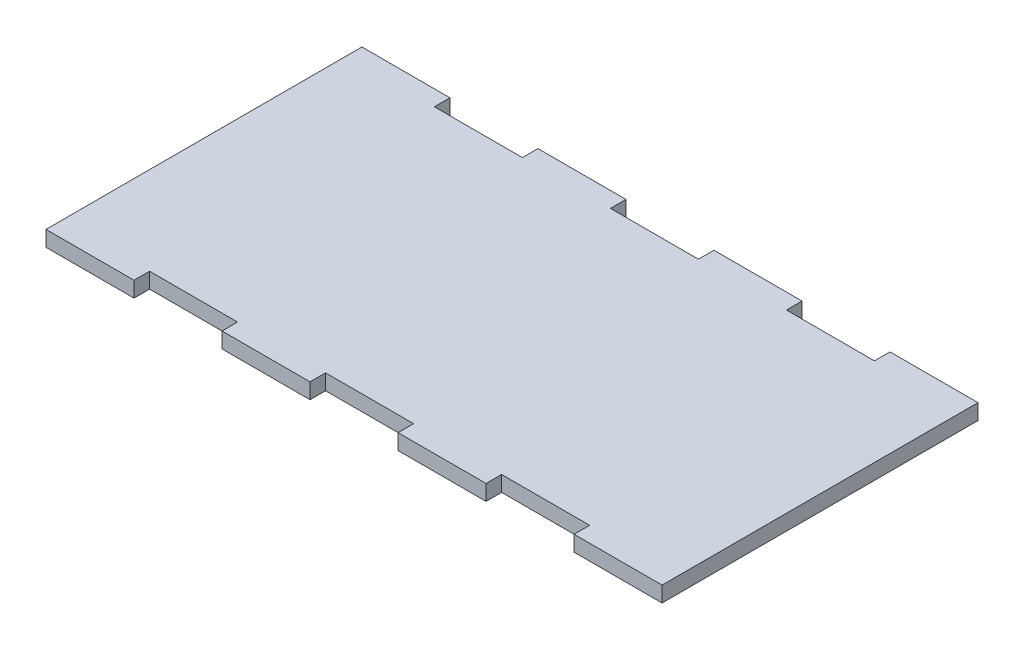
from build123d import *

# Parameters (mm, degrees)
SKETCH1_W           = 99.06
SKETCH1_H           = 50.8
BOSS_EXTRUDE1_DEPTH = 2.5
SKETCH2_W           = 14.151428572
SKETCH2_H           = 2.5
CUT_EXTRUDE1_DEPTH  = 2.54


with BuildPart() as part:
    # Sketch1 → Boss-Extrude1 (new body)
    with BuildSketch(Plane(origin=(0, 0, 0), x_dir=(1, 0, 0), z_dir=(0, 1, 0))):
        Rectangle(SKETCH1_W, SKETCH1_H)
    extrude(amount=BOSS_EXTRUDE1_DEPTH)

    # Sketch2 → Cut-Extrude1 (cut)
    with BuildSketch(Plane(origin=(0, 2.5, 0), x_dir=(1, 0, 0), z_dir=(0, 1, 0))):
        with Locations((-28.302857143, 24.15)):
            Rectangle(SKETCH2_W, SKETCH2_H)
        with Locations((0, 24.15)):
            Rectangle(SKETCH2_W, SKETCH2_H)
        with Locations((28.302857143, 24.15)):
            Rectangle(SKETCH2_W, SKETCH2_H)
        with Locations((-28.302857143, -24.15)):
            Rectangle(SKETCH2_W, SKETCH2_H)
        with Locations((0, -24.15)):
            Rectangle(SKETCH2_W, SKETCH2_H)
        with Locations((28.302857143, -24.15)):
            Rectangle(SKETCH2_W, SKETCH2_H)
    extrude(amount=-CUT_EXTRUDE1_DEPTH, mode=Mode.SUBTRACT)


solid = part.part
